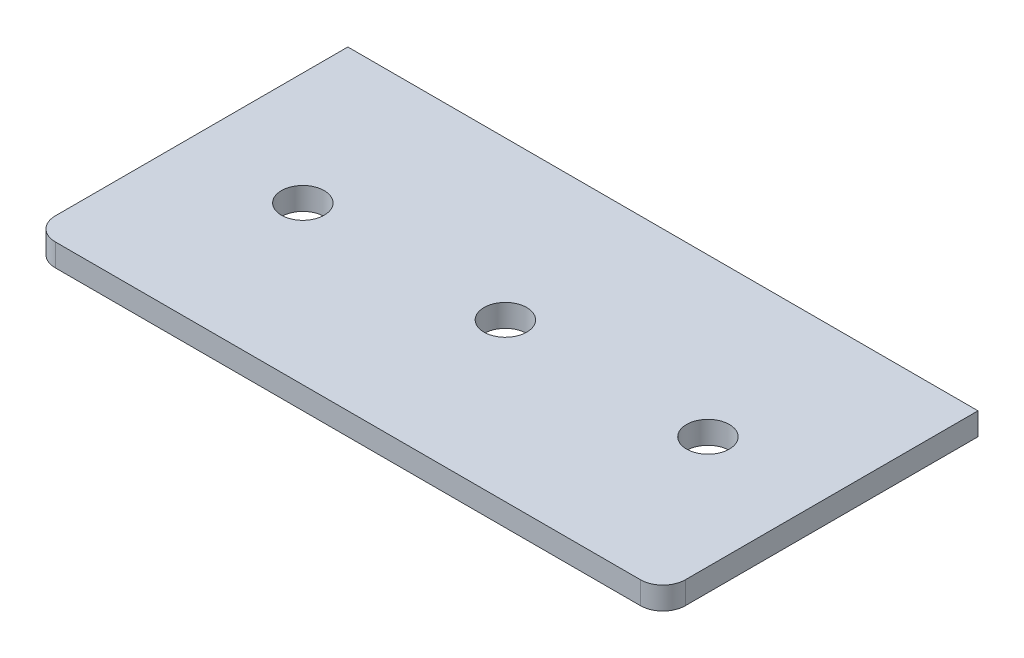
from build123d import *

# Parameters (mm, degrees)
SKETCH1_W           = 280
SKETCH1_H           = 140
BOSS_EXTRUDE1_DEPTH = 10
SKETCH2_R           = 9.5
CUT_EXTRUDE1_DEPTH  = 10
FILLET1_R           = 10


with BuildPart() as part:
    # Sketch1 → Boss-Extrude1 (new body)
    with BuildSketch(Plane(origin=(0, 0, 0), x_dir=(1, 0, 0), z_dir=(0, 1, 0))):
        Rectangle(SKETCH1_W, SKETCH1_H)
    extrude(amount=BOSS_EXTRUDE1_DEPTH)

    # Sketch2 → Cut-Extrude1 (cut)
    with BuildSketch(Plane(origin=(0, 10, 0), x_dir=(1, 0, 0), z_dir=(0, 1, 0))):
        with Locations(Location((-90, 0, 0), (0, 0, 270))):
            Circle(SKETCH2_R)
        with Locations(Location((0, 0, 0), (0, 0, 270))):
            Circle(SKETCH2_R)
    cut_extrude1 = extrude(amount=-CUT_EXTRUDE1_DEPTH, mode=Mode.SUBTRACT)

    # Mirror1: Cut-Extrude1 across plane
    add(cut_extrude1.mirror(Plane(origin=(0, 0, 0), x_dir=(0, 0, 1), z_dir=(1, 0, 0))), mode=Mode.SUBTRACT)

    # Fillet1
    fillet1_edges = [part.edges().sort_by_distance(p)[0] for p in [
        (140, 5, 70),
        (-140, 5, 70),
    ]]
    fillet(fillet1_edges, radius=FILLET1_R)


solid = part.part
